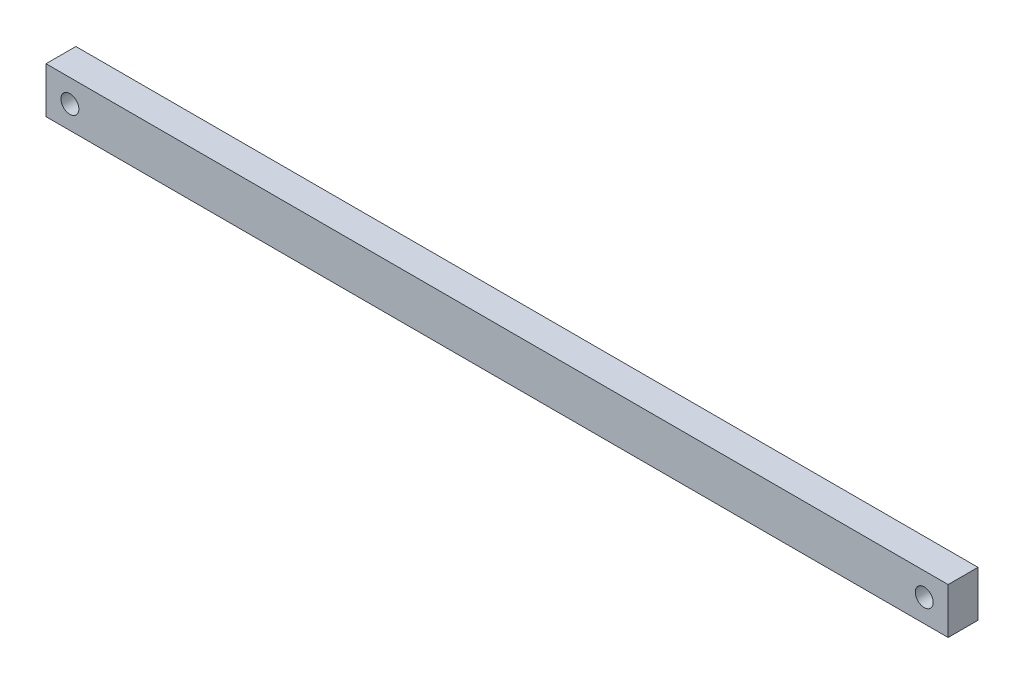
from build123d import *

# Parameters (mm, degrees)
SKETCH1_W           = 755
SKETCH1_H           = 38.389830508
SKETCH1_R           = 7.5
BOSS_EXTRUDE1_DEPTH = 25


with BuildPart() as part:
    # Sketch1 → Boss-Extrude1 (new body)
    with BuildSketch(Plane.XY):
        Rectangle(SKETCH1_W, SKETCH1_H)
        with Locations((-357.5, 0)):
            Circle(SKETCH1_R, mode=Mode.SUBTRACT)
        with Locations((357.5, 0)):
            Circle(SKETCH1_R, mode=Mode.SUBTRACT)
    extrude(amount=BOSS_EXTRUDE1_DEPTH)


solid = part.part
